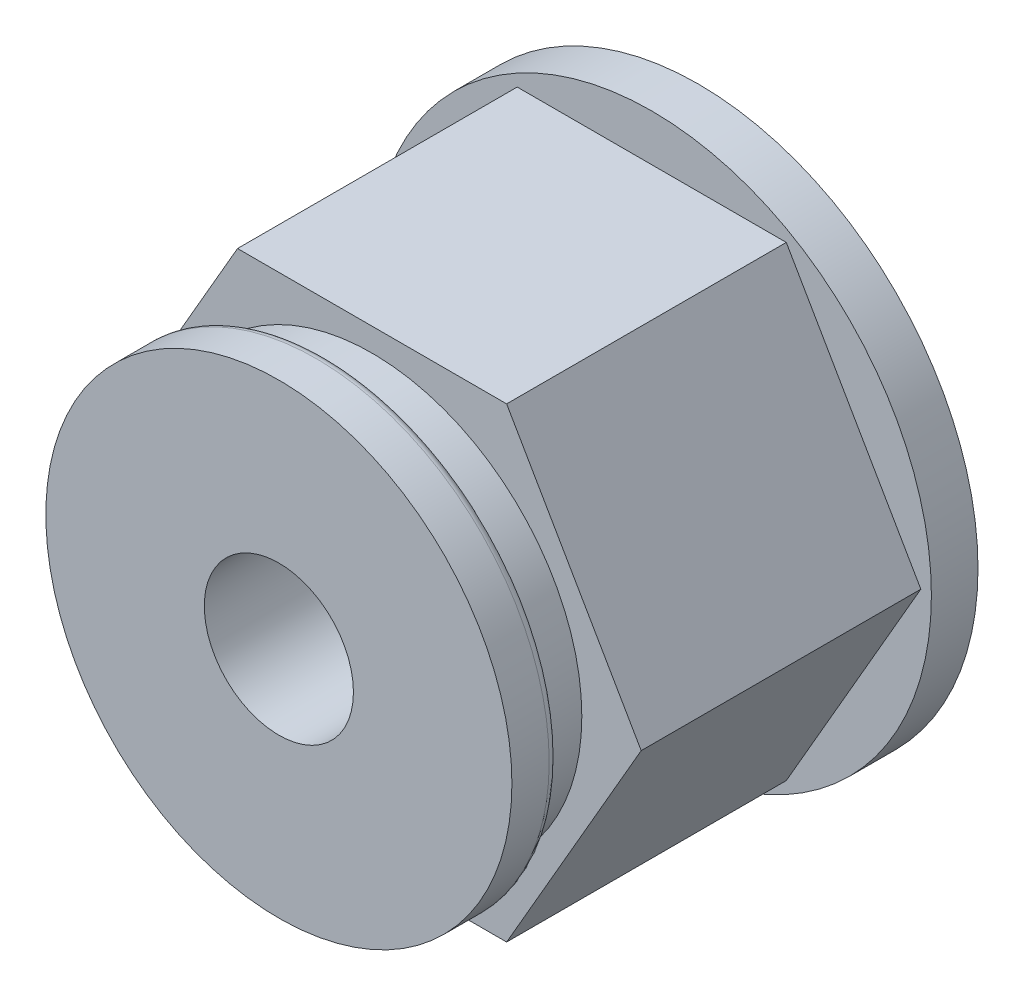
from build123d import *

# Parameters (mm, degrees)
SKETCH1_R           = 7.62
BOSS_EXTRUDE1_DEPTH = 1.27
BOSS_EXTRUDE2_DEPTH = 7.62
SKETCH3_R           = 5.715
BOSS_EXTRUDE3_DEPTH = 1.27
SKETCH4_R           = 6.35
BOSS_EXTRUDE4_DEPTH = 1.27
FILLET1_R           = 0.254
SKETCH5_R           = 2.032
CUT_EXTRUDE1_DEPTH  = 11.43


with BuildPart() as part:
    # Sketch1 → Boss-Extrude1 (new body)
    with BuildSketch(Plane.XY):
        Circle(SKETCH1_R)
    extrude(amount=BOSS_EXTRUDE1_DEPTH)

    # Sketch2 → Boss-Extrude2 (add)
    with BuildSketch(Plane.XY.offset(1.27)):
        Polygon((3.666174209, 6.35), (-3.666174209, 6.35), (-7.332348419, 0), (-3.666174209, -6.35), (3.666174209, -6.35), (7.332348419, 0), align=None)
    extrude(amount=BOSS_EXTRUDE2_DEPTH)

    # Sketch3 → Boss-Extrude3 (add)
    with BuildSketch(Plane.XY.offset(8.89)):
        Circle(SKETCH3_R)
    extrude(amount=BOSS_EXTRUDE3_DEPTH)

    # Sketch4 → Boss-Extrude4 (add)
    with BuildSketch(Plane.XY.offset(10.16)):
        Circle(SKETCH4_R)
    extrude(amount=BOSS_EXTRUDE4_DEPTH)

    # Fillet1
    fillet1_edges = [part.edges().sort_by_distance(p)[0] for p in [
        (-5.715, 0, 10.16),
        (-6.35, 0, 10.16),
    ]]
    fillet(fillet1_edges, radius=FILLET1_R)

    # Sketch5 → Cut-Extrude1 (cut)
    with BuildSketch(Plane.XY.offset(11.43)):
        Circle(SKETCH5_R)
    extrude(amount=-CUT_EXTRUDE1_DEPTH, mode=Mode.SUBTRACT)


solid = part.part
